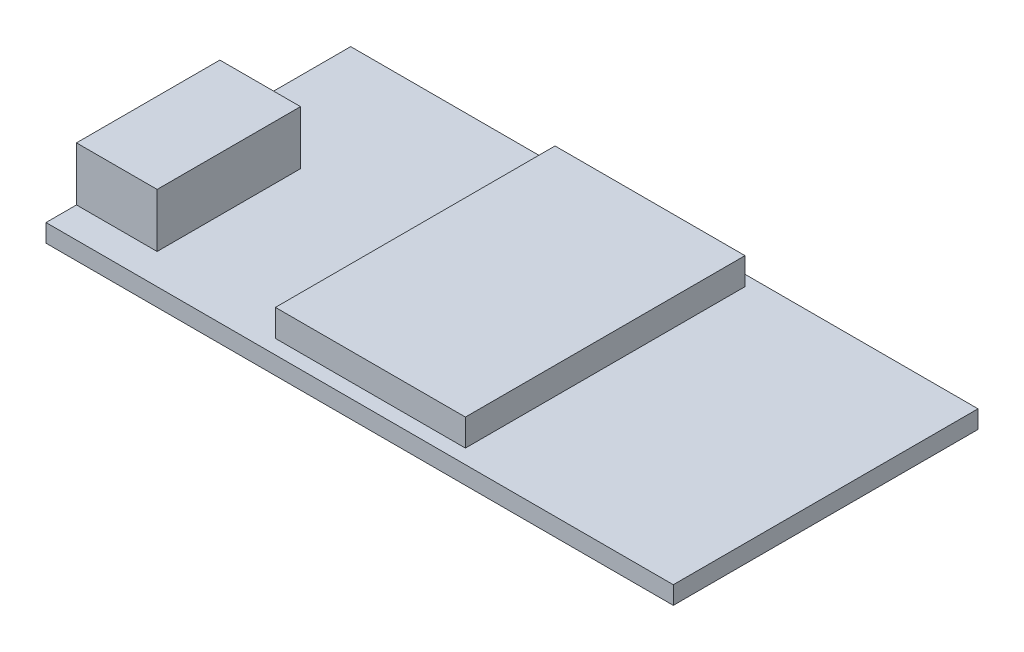
from build123d import *

# Parameters (mm, degrees)
SKETCH1_W           = 35
SKETCH1_H           = 17
BOSS_EXTRUDE1_DEPTH = 0.5
SKETCH2_W           = 4.5
SKETCH2_H           = 8
BOSS_EXTRUDE2_DEPTH = 3
SKETCH3_W           = 10.6
SKETCH3_H           = 15.6
BOSS_EXTRUDE3_DEPTH = 1.5


with BuildPart() as part:
    # Sketch1 → Boss-Extrude1 (new, symmetric)
    with BuildSketch(Plane(origin=(0, 0, 0), x_dir=(1, 0, 0), z_dir=(0, 1, 0))):
        Rectangle(SKETCH1_W, SKETCH1_H)
    extrude(amount=BOSS_EXTRUDE1_DEPTH, both=True)

    # Sketch2 → Boss-Extrude2 (add)
    with BuildSketch(Plane(origin=(0, 0.5, 0), x_dir=(1, 0, 0), z_dir=(0, 1, 0))):
        with Locations((-15.25, -2.8)):
            Rectangle(SKETCH2_W, SKETCH2_H)
    extrude(amount=BOSS_EXTRUDE2_DEPTH)

    # Sketch3 → Boss-Extrude3 (add)
    with BuildSketch(Plane(origin=(0, 0.5, 0), x_dir=(1, 0, 0), z_dir=(0, 1, 0))):
        with Locations((-0.2, 0.1)):
            Rectangle(SKETCH3_W, SKETCH3_H)
    extrude(amount=BOSS_EXTRUDE3_DEPTH)


solid = part.part
